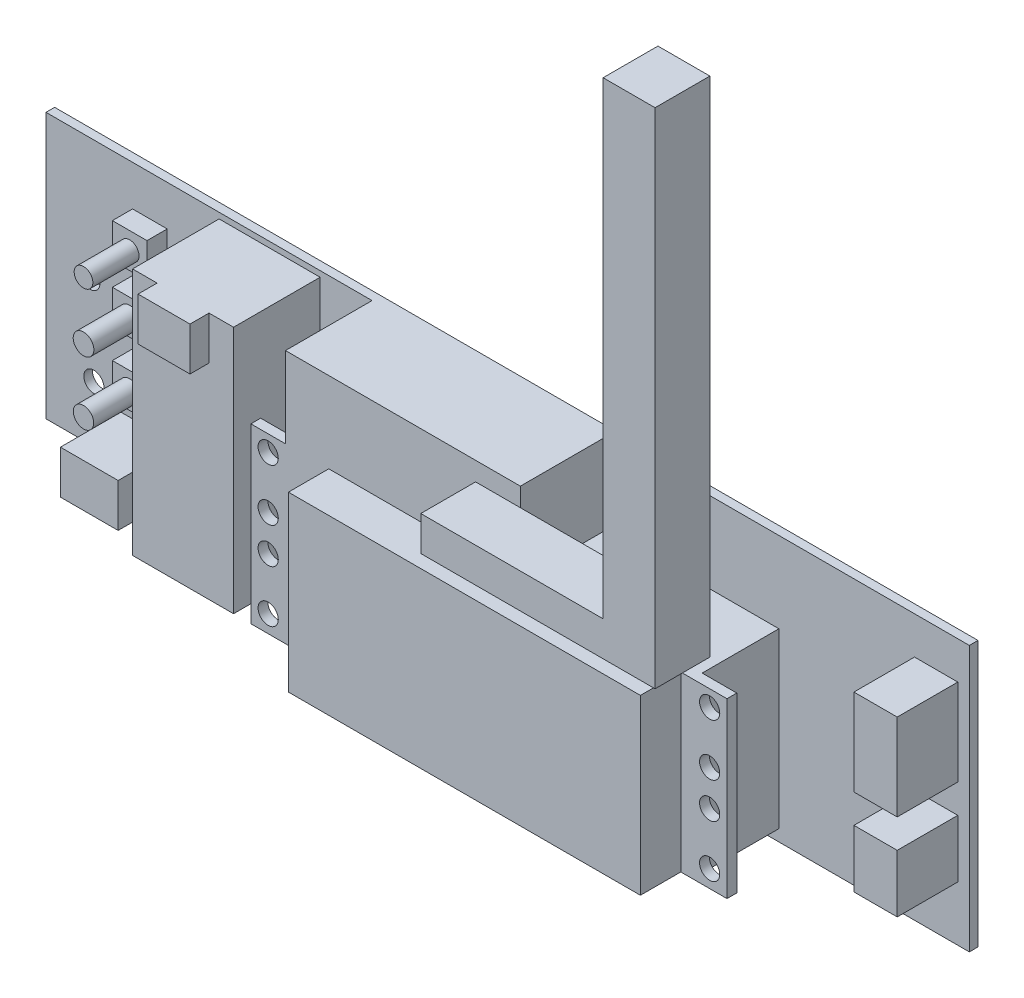
from build123d import *

# Parameters (mm, degrees)
SKICA1_W                      = 160
SKICA1_H                      = 46
P_IDAT_VYSUNUT_M1_DEPTH       = 1.5
ODEBRAT_VYSUNUT_M1_DEPTH      = 84.254129027
ODEBRAT_VYSUNUT_M1_DEPTH_BACK = 84.254129027
SKICA2_R                      = 1.75
SKICA3_W                      = 10
SKICA3_H                      = 7.5
SKICA3_W_2                    = 7.5
SKICA3_H_2                    = 10
SKICA3_H_3                    = 15
P_IDAT_VYSUNUT_M2_DEPTH       = 10.5
SKICA5_W                      = 6
SKICA5_H                      = 6
P_IDAT_VYSUNUT_M3_DEPTH       = 3.5
SKICA6_R                      = 1.620409531
SKICA6_R_2                    = 1.790047617
SKICA6_R_3                    = 1.76567532
P_IDAT_VYSUNUT_M4_DEPTH       = 8
SKICA7_W                      = 17.5
SKICA7_H                      = 43
SKICA7_W_2                    = 70.5
SKICA7_H_2                    = 30
SKICA7_W_3                    = 40.7
SKICA7_H_3                    = 14
P_IDAT_VYSUNUT_M5_DEPTH       = 15
SKICA8_W                      = 9
SKICA8_H                      = 7.5
P_IDAT_VYSUNUT_M6_DEPTH       = 3.3
SKICA13_W                     = 23.838883278
SKICA13_H                     = 6
SKICA13_W_2                   = 9
SKICA13_H_2                   = 81.2
SKICA13_W_3                   = 7.761116722
P_IDAT_VYSUNUT_M7_DEPTH       = 9.5
SKICA14_W                     = 61
SKICA14_H                     = 30
P_IDAT_VYSUNUT_M8_DEPTH       = 7
SKICA15_W                     = 6
SKICA15_H                     = 30
SKICA15_R                     = 1.75
P_IDAT_VYSUNUT_M9_DEPTH       = 1.7


with BuildPart() as part:
    # Skica1 → Přidat vysunutím1 (new body)
    with BuildSketch(Plane.XY):
        Rectangle(SKICA1_W, SKICA1_H)
    extrude(amount=P_IDAT_VYSUNUT_M1_DEPTH)

    # Skica2 → Odebrat vysunutím1 (cut, two sides: drawn at the far end of the back side and taken through both)
    with BuildSketch(Plane.XY.offset(1.5).offset(-ODEBRAT_VYSUNUT_M1_DEPTH_BACK)):
        with Locations((-71.7, -13.3)):
            Circle(SKICA2_R)
        with Locations((-72.4, 2)):
            Circle(SKICA2_R)
        with Locations((62.7, 3.2)):
            Circle(SKICA2_R)
        with Locations((62.7, -14.6)):
            Circle(SKICA2_R)
    extrude(amount=ODEBRAT_VYSUNUT_M1_DEPTH + ODEBRAT_VYSUNUT_M1_DEPTH_BACK, mode=Mode.SUBTRACT)

    # Skica3 → Přidat vysunutím2 (add)
    with BuildSketch(Plane.XY.offset(1.5)):
        with Locations((-62, -19.25)):
            Rectangle(SKICA3_W, SKICA3_H)
        with Locations((74.25, -8.5)):
            Rectangle(SKICA3_W_2, SKICA3_H_2)
        with Locations((74.25, 9)):
            Rectangle(SKICA3_W_2, SKICA3_H_3)
    extrude(amount=P_IDAT_VYSUNUT_M2_DEPTH)

    # Skica5 → Přidat vysunutím3 (add)
    with BuildSketch(Plane.XY.offset(1.5)):
        with Locations((-62, -8)):
            Rectangle(SKICA5_W, SKICA5_H)
        with Locations((-62, 3)):
            Rectangle(SKICA5_W, SKICA5_H)
        with Locations((-62, 13)):
            Rectangle(SKICA5_W, SKICA5_H)
    extrude(amount=P_IDAT_VYSUNUT_M3_DEPTH)

    # Skica6 → Přidat vysunutím4 (add)
    with BuildSketch(Plane.XY.offset(5)):
        with Locations((-62, 13)):
            Circle(SKICA6_R)
        with Locations((-62, 3)):
            Circle(SKICA6_R_2)
        with Locations((-62, -8)):
            Circle(SKICA6_R_3)
    extrude(amount=P_IDAT_VYSUNUT_M4_DEPTH)

    # Skica7 → Přidat vysunutím5 (add)
    with BuildSketch(Plane.XY.offset(1.5)):
        with Locations((-41.25, 0.5)):
            Rectangle(SKICA7_W, SKICA7_H)
        with Locations((11.75, -6)):
            Rectangle(SKICA7_W_2, SKICA7_H_2)
        with Locations((-3.15, 16)):
            Rectangle(SKICA7_W_3, SKICA7_H_3)
    extrude(amount=P_IDAT_VYSUNUT_M5_DEPTH)

    # Skica8 → Přidat vysunutím6 (add)
    with BuildSketch(Plane.XY.offset(16.5)):
        with Locations((-41.25, 18.25)):
            Rectangle(SKICA8_W, SKICA8_H)
    extrude(amount=P_IDAT_VYSUNUT_M6_DEPTH)

    # Skica13 → Přidat vysunutím7 (add)
    with BuildSketch(Plane.XY.offset(16.5)):
        with Locations((29.119441639, 16.761519328)):
            Rectangle(SKICA13_W, SKICA13_H)
        with Locations((45.538883278, 16.761519328)):
            Rectangle(SKICA13_W_2, SKICA13_H)
        with Locations((45.538883278, 60.361519328)):
            Rectangle(SKICA13_W_2, SKICA13_H_2)
        with Locations((13.319441639, 16.761519328)):
            Rectangle(SKICA13_W_3, SKICA13_H)
    extrude(amount=P_IDAT_VYSUNUT_M7_DEPTH)

    # Skica14 → Přidat vysunutím8 (add)
    with BuildSketch(Plane.XY.offset(16.5)):
        with Locations((14.5, -6)):
            Rectangle(SKICA14_W, SKICA14_H)
    extrude(amount=P_IDAT_VYSUNUT_M8_DEPTH)

    # Skica15 → Přidat vysunutím9 (add)
    # profile 1 of 2: a face of its own
    with BuildSketch(Plane.XY.offset(16.5)):
        with Locations((-26.5, -6)):
            Rectangle(SKICA15_W, SKICA15_H)
        with Locations((-26.5, -18)):
            Circle(SKICA15_R, mode=Mode.SUBTRACT)
        with Locations((-26.5, 6.2)):
            Circle(SKICA15_R, mode=Mode.SUBTRACT)
        with Locations((-26.5, -9)):
            Circle(SKICA15_R, mode=Mode.SUBTRACT)
        with Locations((-26.5, -2.8)):
            Circle(SKICA15_R, mode=Mode.SUBTRACT)
    # profile 2 of 2: a face of its own
    with BuildSketch(Plane.XY.offset(16.5)):
        with Locations((50, -6)):
            Rectangle(SKICA15_W, SKICA15_H)
        with Locations((50, -18)):
            Circle(SKICA15_R, mode=Mode.SUBTRACT)
        with Locations((50, -9)):
            Circle(SKICA15_R, mode=Mode.SUBTRACT)
        with Locations((50, -2.8)):
            Circle(SKICA15_R, mode=Mode.SUBTRACT)
        with Locations((50, 6.2)):
            Circle(SKICA15_R, mode=Mode.SUBTRACT)
    extrude(amount=-P_IDAT_VYSUNUT_M9_DEPTH)


solid = part.part
